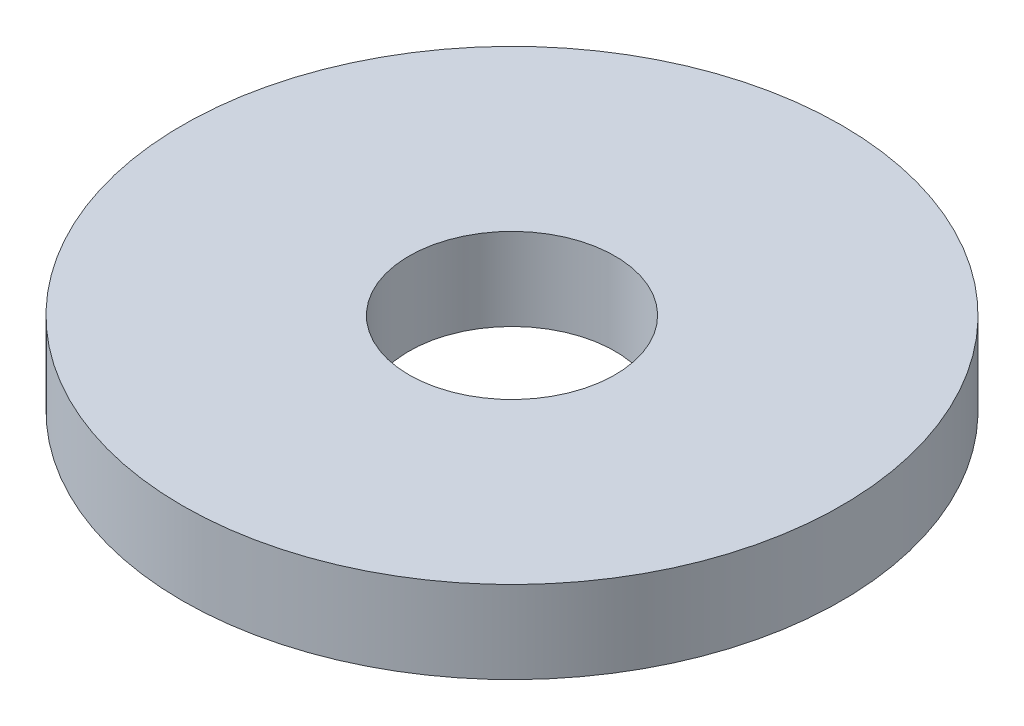
from build123d import *

# Parameters (mm, degrees)
SKETCH1_R           = 40
SKETCH1_R_2         = 12.5
BOSS_EXTRUDE1_DEPTH = 10


with BuildPart() as part:
    # Sketch1 → Boss-Extrude1 (new body)
    with BuildSketch(Plane(origin=(0, 0, 0), x_dir=(1, 0, 0), z_dir=(0, 1, 0))):
        with Locations(Location((0, 0, 0), (0, 0, 270))):
            Circle(SKETCH1_R)
        with Locations(Location((0, 0, 0), (0, 0, 270))):
            Circle(SKETCH1_R_2, mode=Mode.SUBTRACT)
    extrude(amount=BOSS_EXTRUDE1_DEPTH)


solid = part.part
